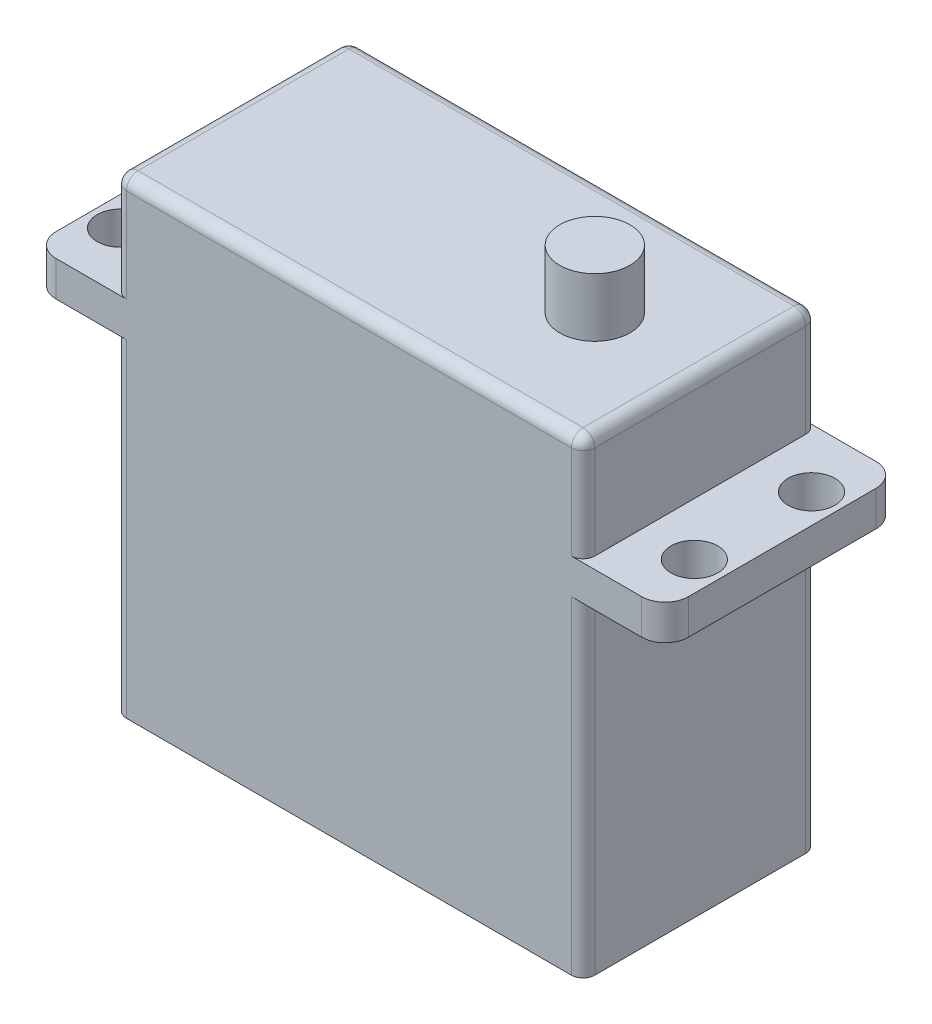
from build123d import *

# Parameters (mm, degrees)
BOSS_EXTRUDE1_DEPTH = 20
SKETCH2_R           = 2
CUT_EXTRUDE1_DEPTH  = 20
FILLET1_R           = 2
FILLET2_R           = 1
SKETCH3_R           = 3
BOSS_EXTRUDE2_DEPTH = 5


with BuildPart() as part:
    # Sketch1 → Boss-Extrude1 (new body)
    with BuildSketch(Plane.XY):
        with BuildLine():
            Line((20, 14), (27, 14))
            Line((27, 14), (27, 17))
            Line((27, 17), (20, 17))
            Line((20, 17), (20, 25))
            ThreePointArc((20, 25), (19.707106781, 25.707106781), (19, 26))
            Line((19, 26), (-19, 26))
            ThreePointArc((-19, 26), (-19.707106781, 25.707106781), (-20, 25))
            Line((-20, 25), (-20, 17))
            Line((-20, 17), (-27, 17))
            Line((-27, 17), (-27, 14))
            Line((-27, 14), (-20, 14))
            Line((-20, 14), (-20, -14))
            Line((-20, -14), (20, -14))
            Line((20, -14), (20, 14))
        make_face()
    extrude(amount=BOSS_EXTRUDE1_DEPTH)

    # Sketch2 → Cut-Extrude1 (cut)
    with BuildSketch(Plane(origin=(0, 17, 0), x_dir=(1, 0, 0), z_dir=(0, 1, 0))):
        with Locations(Location((-24.5, -5, 0), (0, 0, 270))):
            Circle(SKETCH2_R)
        with Locations(Location((-24.5, -15, 0), (0, 0, 270))):
            Circle(SKETCH2_R)
    cut_extrude1 = extrude(amount=-CUT_EXTRUDE1_DEPTH, mode=Mode.SUBTRACT)

    # Mirror1: Cut-Extrude1 across plane
    add(cut_extrude1.mirror(Plane(origin=(0, 0, 0), x_dir=(0, 0, 1), z_dir=(1, 0, 0))), mode=Mode.SUBTRACT)

    # Fillet1
    fillet1_edges = [part.edges().sort_by_distance(p)[0] for p in [
        (27, 15.5, 20),
        (-27, 15.5, 0),
        (27, 15.5, 0),
        (-27, 15.5, 20),
    ]]
    fillet(fillet1_edges, radius=FILLET1_R)

    # Fillet2
    fillet2_edges = [part.edges().sort_by_distance(p)[0] for p in [
        (-20, 0, 0),
        (-20, 21, 0),
        (-19.707106781, 25.707106781, 0),
        (0, 26, 0),
        (19.707106781, 25.707106781, 0),
        (20, 21, 0),
        (20, 0, 0),
        (20, 21, 20),
        (19.707106781, 25.707106781, 20),
        (0, 26, 20),
        (-19.707106781, 25.707106781, 20),
        (-20, 21, 20),
        (20, 0, 20),
        (-20, 0, 20),
    ]]
    fillet(fillet2_edges, radius=FILLET2_R)

    # Sketch3 → Boss-Extrude2 (add)
    with BuildSketch(Plane(origin=(0, 26, 0), x_dir=(1, 0, 0), z_dir=(0, 1, 0))):
        with Locations(Location((11, -10, 0), (0, 0, 270))):
            Circle(SKETCH3_R)
    extrude(amount=BOSS_EXTRUDE2_DEPTH)


solid = part.part
